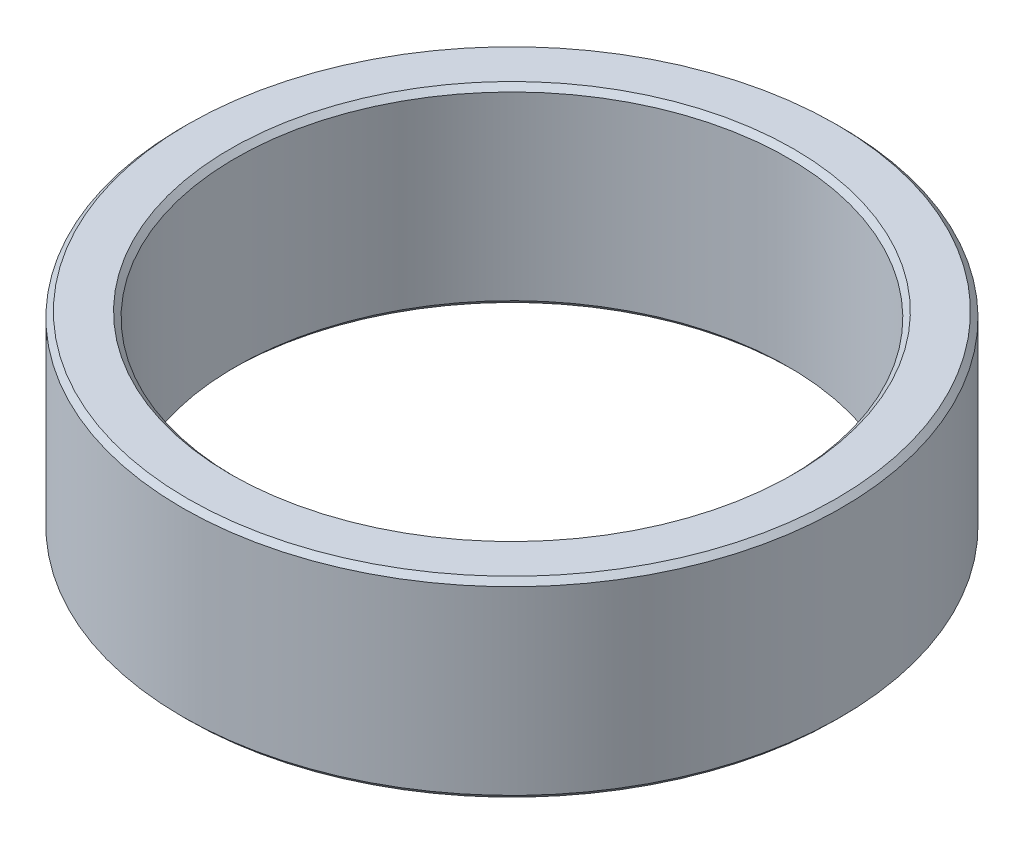
from build123d import *

# Parameters (mm, degrees)
SCHIZZO1_R        = 31
SCHIZZO1_R_2      = 26
ESTRUSIONE1_DEPTH = 18
SMUSSO1_SIZE      = 0.5


with BuildPart() as part:
    # Schizzo1 → Estrusione1 (new body)
    with BuildSketch(Plane(origin=(0, 0, 0), x_dir=(1, 0, 0), z_dir=(0, 1, 0))):
        with Locations(Location((0, 0, 0), (0, 0, 270))):
            Circle(SCHIZZO1_R)
        with Locations(Location((0, 0, 0), (0, 0, 270))):
            Circle(SCHIZZO1_R_2, mode=Mode.SUBTRACT)
    extrude(amount=ESTRUSIONE1_DEPTH)

    # Smusso1
    smusso1_edges = [part.edges().sort_by_distance(p)[0] for p in [
        (0, 0, -31),
        (0, 18, -31),
        (0, 0, -26),
        (0, 18, -26),
    ]]
    chamfer(smusso1_edges, length=SMUSSO1_SIZE)


solid = part.part
